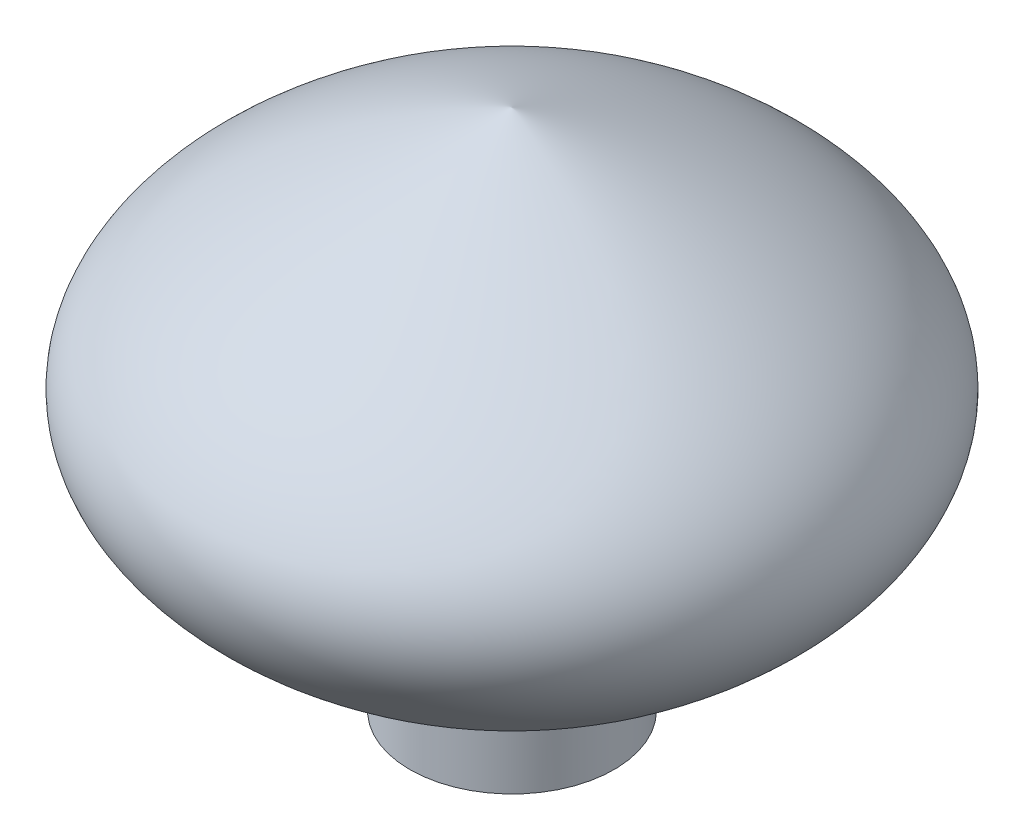
from build123d import *

# Parameters (mm, degrees)
SKETCH9_R           = 2
BOSS_EXTRUDE1_DEPTH = 2


with BuildPart() as part:
    # Sketch5 → Revolve2 (revolve)
    with BuildSketch(Plane(origin=(0, 0, 0), x_dir=(0, 0, -1), z_dir=(1, 0, 0))):
        with BuildLine():
            Line((0, -1.305492492), (0, 8.226206899))
            add(Edge.make_bspline(
                [(0, 8.226206899), (12.899965566, 3.460357203), (0, -1.305492492)],
                knots=[0, 0, 0, 1, 1, 1], degree=2))
        make_face()
    revolve(axis=Axis((0, -1.305492492, 0), (0, 1, 0)))

    # Sketch9 → Boss-Extrude1 (add)
    with BuildSketch(Plane(origin=(0, 0, 0), x_dir=(1, 0, 0), z_dir=(0, 1, 0))):
        with Locations(Location((0, 0, 0), (0, 0, 270))):
            Circle(SKETCH9_R)
    extrude(amount=-BOSS_EXTRUDE1_DEPTH)


solid = part.part
